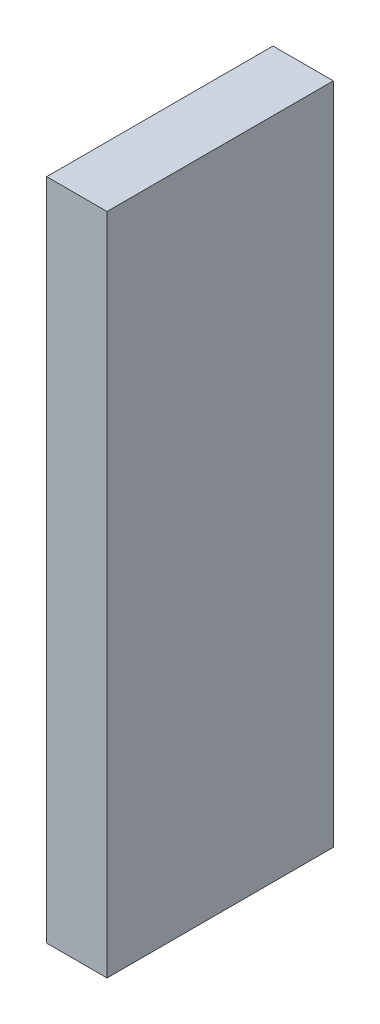
from build123d import *

# Parameters (mm, degrees)
SKETCH_1_W         = 4
SKETCH_1_H         = 44
MOUNT_SPACER_DEPTH = 15


with BuildPart() as part:
    # 草图1 → Mount_spacer (new body)
    with BuildSketch(Plane.XY):
        with Locations((2, 22)):
            Rectangle(SKETCH_1_W, SKETCH_1_H)
    extrude(amount=MOUNT_SPACER_DEPTH)


solid = part.part
